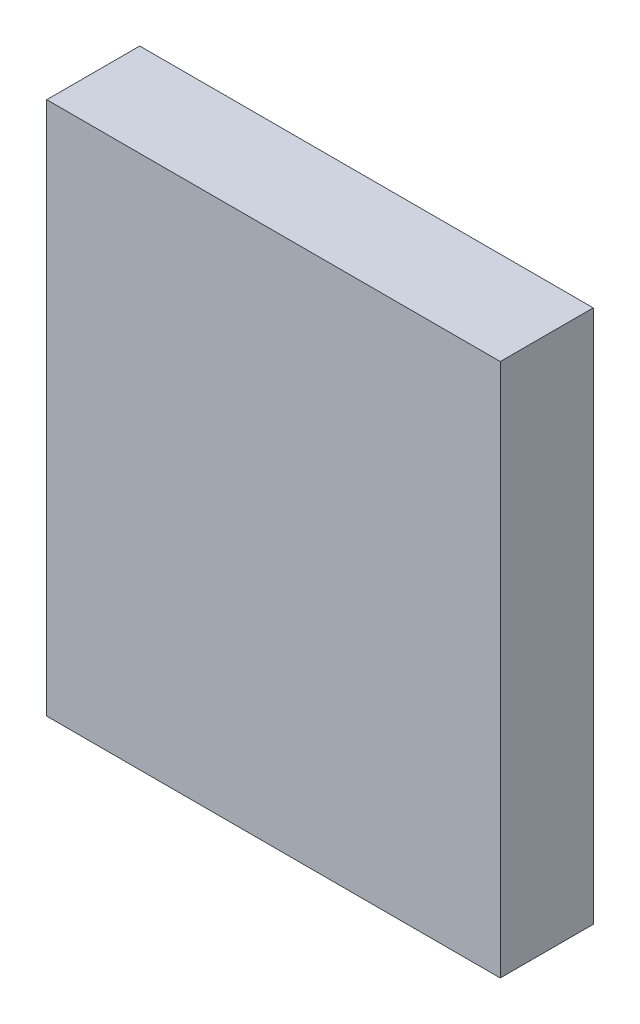
from build123d import *

# Parameters (mm, degrees)
SKETCH1_W               = 4.8764
SKETCH1_H               = 5.7404
COMPONENT_OUTLINE_DEPTH = 1


with BuildPart() as part:
    # Sketch1 → Component_Outline (new body)
    with BuildSketch(Plane.XY):
        Rectangle(SKETCH1_W, SKETCH1_H)
    extrude(amount=COMPONENT_OUTLINE_DEPTH)


solid = part.part
